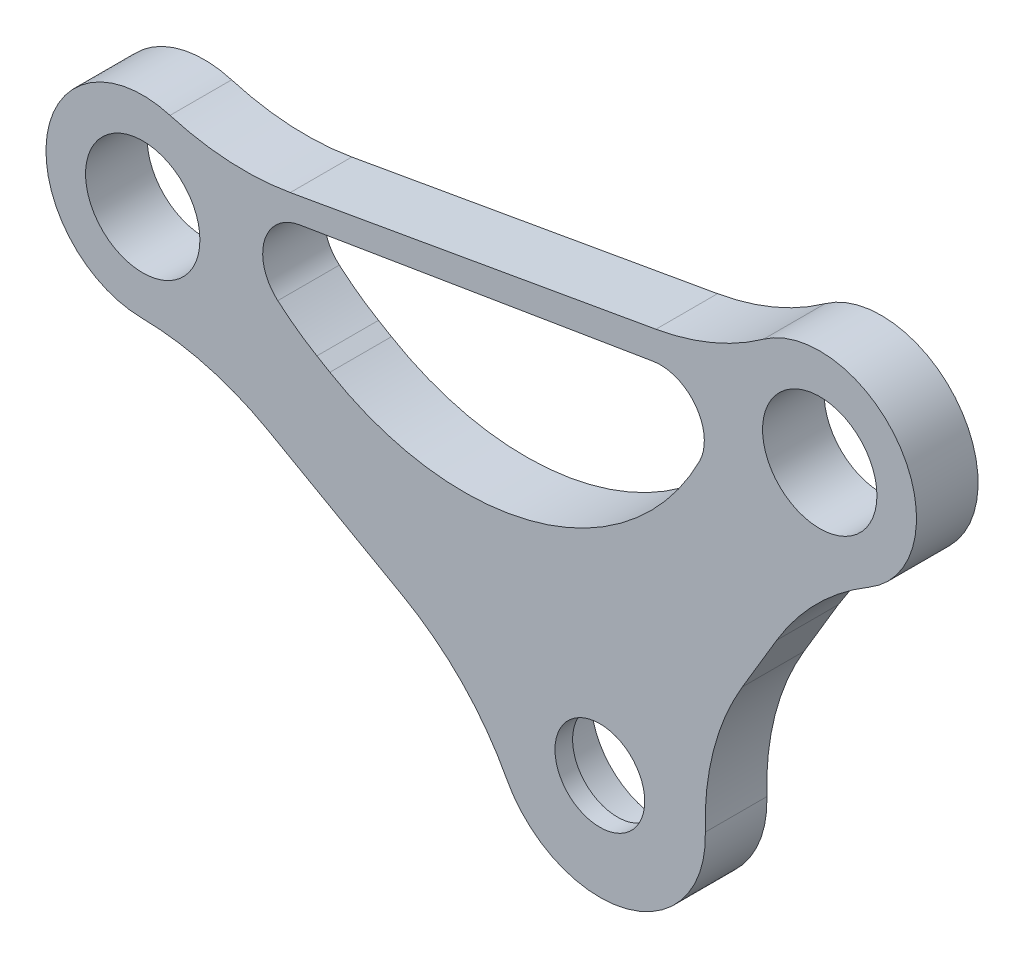
from build123d import *

# Parameters (mm, degrees)
SKETCH_3_R          = 6.5
SKETCH_3_R_2        = 5.1
EXTRUDE_1_DEPTH     = 7
SKETCH_4_R          = 8
CUT_EXTRUDE_1_DEPTH = 5


with BuildPart() as part:
    # 草图3 → 凸台-拉伸1 (new body)
    with BuildSketch(Plane.XY):
        with BuildLine():
            Line((-22.387222404, 6.481913971), (-37.741822074, 15.137156625))
            ThreePointArc((-37.741822074, 15.137156625), (-44.677179157, 17.972501845), (-52.098826017, 19.000858921))
            ThreePointArc((-52.098826017, 19.000858921), (-62.839328708, 31.635038635), (-48.859263412, 40.553484096))
            ThreePointArc((-48.859263412, 40.553484096), (-42.068238936, 39.382208167), (-35.189110999, 39.791475278))
            Line((-35.189110999, 39.791475278), (6.380330607, 47.121287778))
            ThreePointArc((6.380330607, 47.121287778), (12.780626397, 49.003020007), (18.606824384, 52.252653742))
            ThreePointArc((18.606824384, 52.252653742), (34.217539735, 49.304351078), (30.601923927, 33.834566184))
            ThreePointArc((30.601923927, 33.834566184), (24.699361424, 29.262109391), (20.108758873, 23.373648349))
            Line((20.108758873, 23.373648349), (16.20338738, 16.820058769))
            ThreePointArc((16.20338738, 16.820058769), (12.916733667, 8.922247815), (11.992720655, 0.417913012))
            ThreePointArc((11.992720655, 0.417913012), (3.095129334, -11.593971468), (-10.60533968, -5.614870459))
            ThreePointArc((-10.60533968, -5.614870459), (-15.627603439, 1.279586072), (-22.387222404, 6.481913971))
        make_face()
        with Locations((-51.961523087, 30.000001974)):
            Circle(SKETCH_3_R, mode=Mode.SUBTRACT)
        with Locations((25.000001645, 43.30126924)):
            Circle(SKETCH_3_R, mode=Mode.SUBTRACT)
        Circle(SKETCH_3_R_2, mode=Mode.SUBTRACT)
        with BuildLine():
            Line((6.06060926, 43.804004569), (-34.143508536, 37.139474198))
            ThreePointArc((-34.143508536, 37.139474198), (-38.136023536, 33.571352415), (-36.611887481, 28.438256042))
            ThreePointArc((-36.611887481, 28.438256042), (-34.460833245, 26.729480075), (-32.162485272, 25.224639143))
            Line((-32.162485272, 25.224639143), (-30.686333973, 24.351977435))
            ThreePointArc((-30.686333973, 24.351977435), (-7.018632683, 21.377002096), (11.337823614, 36.610224829))
            ThreePointArc((11.337823614, 36.610224829), (10.909838082, 41.82878296), (6.06060926, 43.804004569))
        make_face(mode=Mode.SUBTRACT)
    extrude(amount=EXTRUDE_1_DEPTH)

    # 草图4 → 切除-拉伸1 (cut)
    with BuildSketch(Plane(origin=(0, 0, 0), x_dir=(-1, 0, 0), z_dir=(0, 0, -1))):
        Circle(SKETCH_4_R)
    extrude(amount=-CUT_EXTRUDE_1_DEPTH, mode=Mode.SUBTRACT)


solid = part.part
